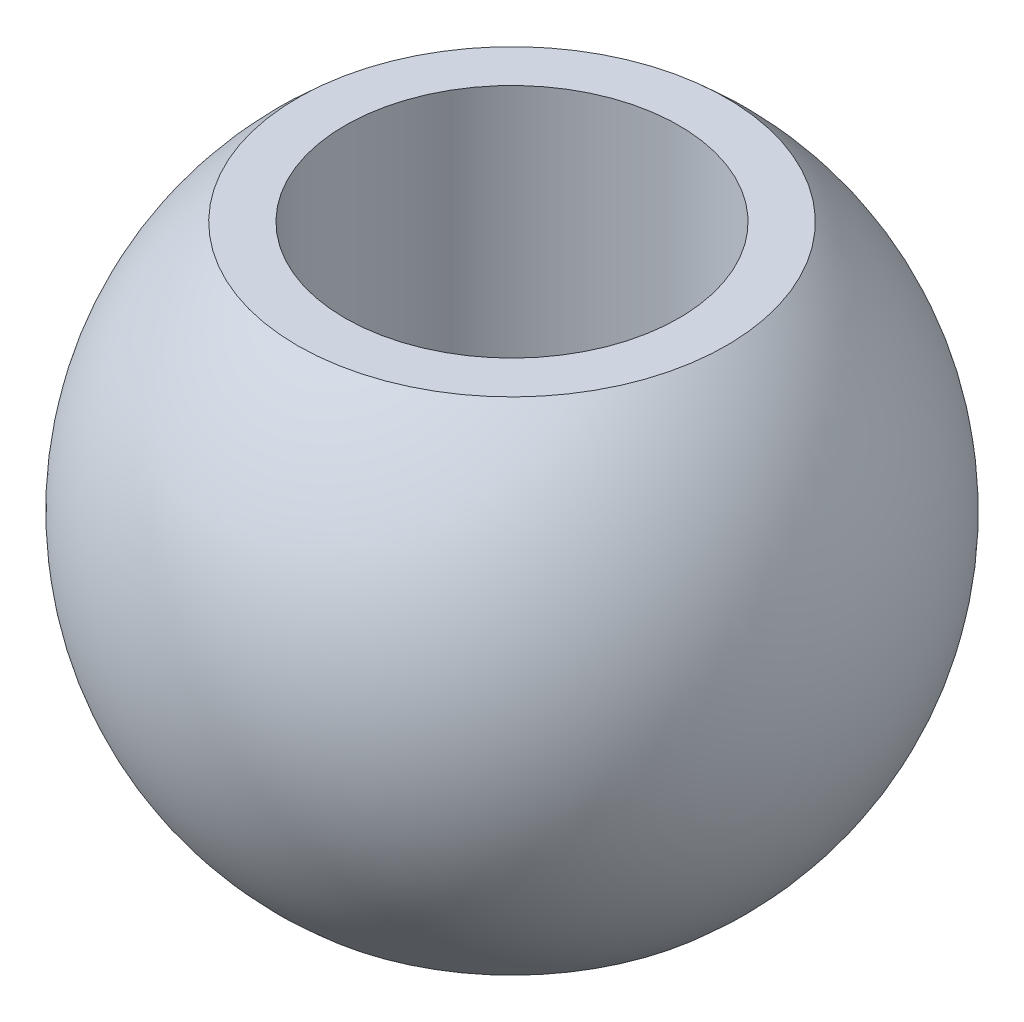
from build123d import *

# Parameters (mm, degrees)
CUT_EXTRUDE1_DEPTH      = 14.68320138
CUT_EXTRUDE1_DEPTH_BACK = 14.68320138
CUT_EXTRUDE2_DEPTH      = 18.833395639
CUT_EXTRUDE2_DEPTH_BACK = 18.833395639
SKETCH3_R               = 4


with BuildPart() as part:
    # Sketch1 → Revolve1 (revolve)
    with BuildSketch(Plane(origin=(0, 0, 0), x_dir=(1, 0, 0), z_dir=(0, 1, 0))):
        with BuildLine():
            Line((-7.9, 0), (7.9, 0))
            ThreePointArc((7.9, 0), (0, 7.9), (-7.9, 0))
        make_face()
    revolve(axis=Axis((-7.9, 0, 0), (1, 0, 0)))

    # Sketch2 → Cut-Extrude1 (cut, two sides: drawn at the far end of the back side and taken through both)
    with BuildSketch(Plane(origin=(0, 0, 0), x_dir=(0, 0, -1), z_dir=(1, 0, 0)).offset(-CUT_EXTRUDE1_DEPTH_BACK)):
        Polygon((-10.115315868, 6), (0, 6), (11.00191489, 6), (11.00191489, 8.344280855), (-10.115315868, 8.344280855), align=None)
        Polygon((12.702210828, -6), (0, -6), (-10.27655801, -6), (-10.27655801, -8.646609871), (12.702210828, -8.646609871), align=None)
    extrude(amount=CUT_EXTRUDE1_DEPTH + CUT_EXTRUDE1_DEPTH_BACK, mode=Mode.SUBTRACT)

    # Sketch3 → Cut-Extrude2 (cut, two sides: drawn at the far end of the back side and taken through both)
    with BuildSketch(Plane(origin=(0, 6, 0), x_dir=(1, 0, 0), z_dir=(0, 1, 0)).offset(-CUT_EXTRUDE2_DEPTH_BACK)):
        with Locations(Location((0, 0, 0), (0, 0, 270))):
            Circle(SKETCH3_R)
    extrude(amount=CUT_EXTRUDE2_DEPTH + CUT_EXTRUDE2_DEPTH_BACK, mode=Mode.SUBTRACT)


solid = part.part
